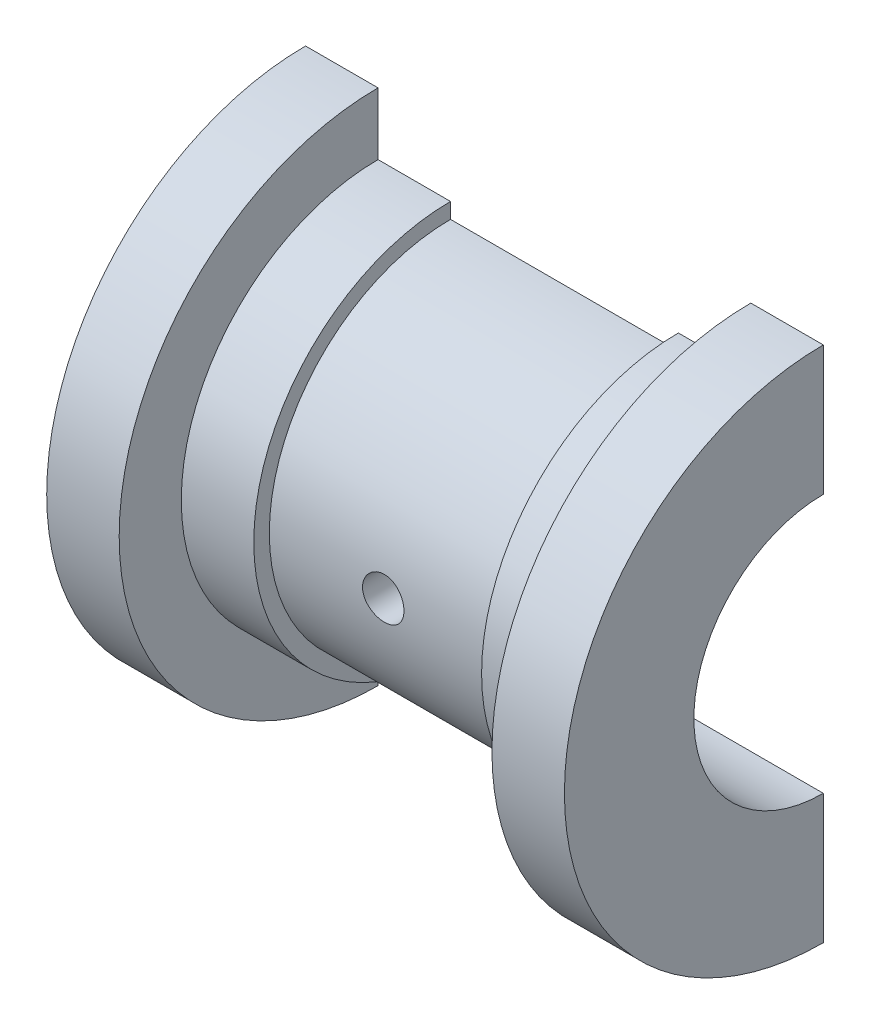
from build123d import *

# Parameters (mm, degrees)
REVOLVE1_ANGLE     = 180
CUT_EXTRUDE3_DEPTH = 50
SKETCH4_R          = 2
CUT_EXTRUDE4_DEPTH = 43


with BuildPart() as part:
    # Sketch1 → Revolve1 (revolve)
    with BuildSketch(Plane.XY):
        Polygon((25, 0), (-25, 0), (-25, 25), (-18, 25), (-18, 19), (-11, 19), (-11, 17.5), (11, 17.5), (11, 19), (18, 19), (18, 25), (25, 25), align=None)
    revolve(axis=Axis((-38.949360705, 0, 0), (1, 0, 0)), revolution_arc=REVOLVE1_ANGLE)

    # Sketch2 → Cut-Extrude3 (cut)
    with BuildSketch(Plane.ZY.offset(25)):
        with BuildLine():
            Line((0, 12.5), (0, -12.5))
            ThreePointArc((0, -12.5), (12.5, 0), (0, 12.5))
        make_face()
    extrude(amount=-CUT_EXTRUDE3_DEPTH, mode=Mode.SUBTRACT)

    # Sketch4 → Cut-Extrude4 (cut)
    with BuildSketch(Plane(origin=(0, 0, 17.5), x_dir=(-1, 0, 0), z_dir=(0, 0, -1))):
        with Locations(Location((0, 0, 0), (0, 0, 270))):
            Circle(SKETCH4_R)
    extrude(amount=CUT_EXTRUDE4_DEPTH, mode=Mode.SUBTRACT)


solid = part.part
